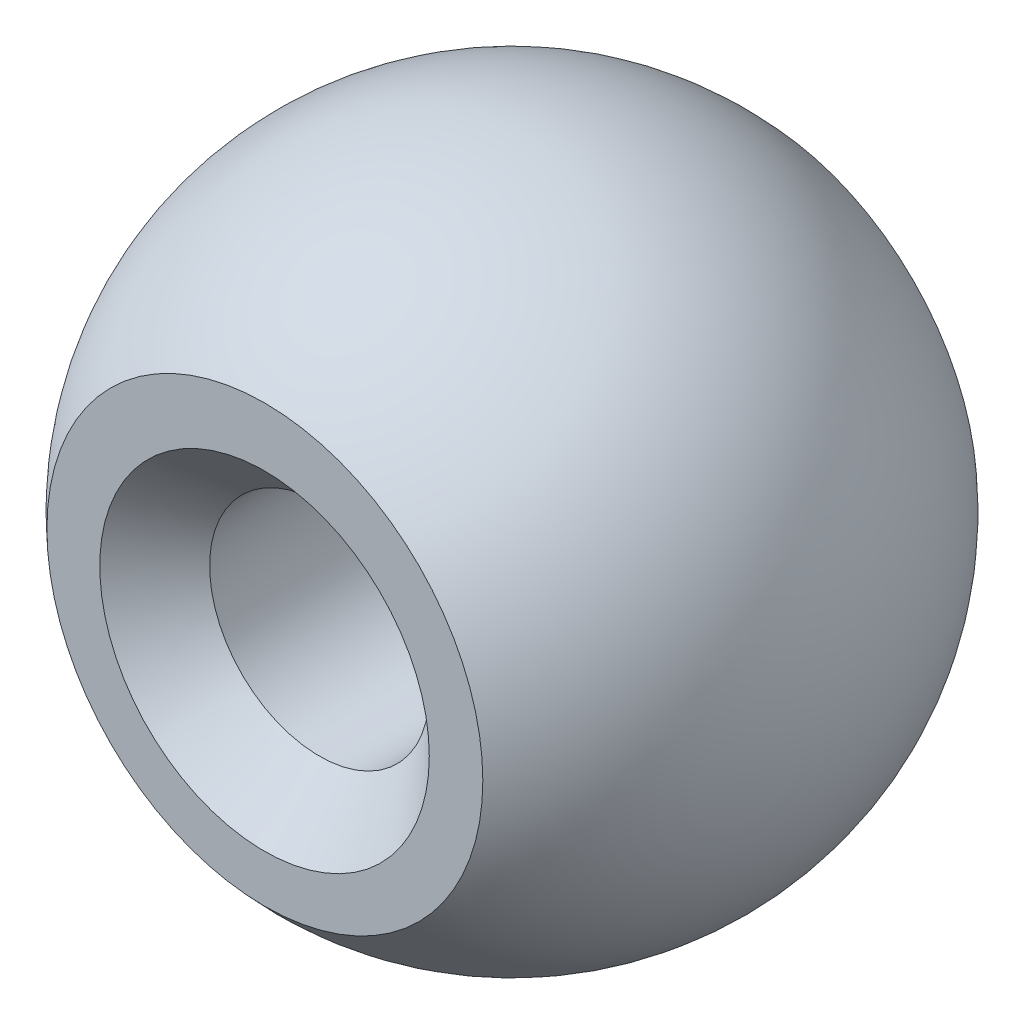
from build123d import *

# Parameters (mm, degrees)
CSK_FOR_M2_FLAT_HEAD_MACHINE_SCREW3_D           = 4
CSK_FOR_M2_FLAT_HEAD_MACHINE_SCREW3_CSINK_D     = 6
CSK_FOR_M2_FLAT_HEAD_MACHINE_SCREW3_CSINK_ANGLE = 90


with BuildPart() as part:
    # Sketch1 → Revolve1 (revolve)
    with BuildSketch(Plane(origin=(0, 0, 0), x_dir=(1, 0, 0), z_dir=(0, 1, 0))):
        with BuildLine():
            Line((0, 4.5), (3.968626967, 4.5))
            ThreePointArc((3.968626967, 4.5), (6, 0), (3.968626967, -4.5))
            Line((3.968626967, -4.5), (0, -4.5))
            Line((0, -4.5), (0, 4.5))
        make_face()
    revolve(axis=Axis((0, 0, -4.5), (0, 0, 1)))

    # CSK for M2 Flat Head Machine Screw3 (through all)
    with Locations(Plane(origin=(-0.006006248, -0.103314566, 4.5), x_dir=(1, 0, 0), z_dir=(0, 0, 1))):
        with Locations((0, 0)):
            CounterSinkHole(CSK_FOR_M2_FLAT_HEAD_MACHINE_SCREW3_D / 2, CSK_FOR_M2_FLAT_HEAD_MACHINE_SCREW3_CSINK_D / 2, counter_sink_angle=CSK_FOR_M2_FLAT_HEAD_MACHINE_SCREW3_CSINK_ANGLE)


solid = part.part
